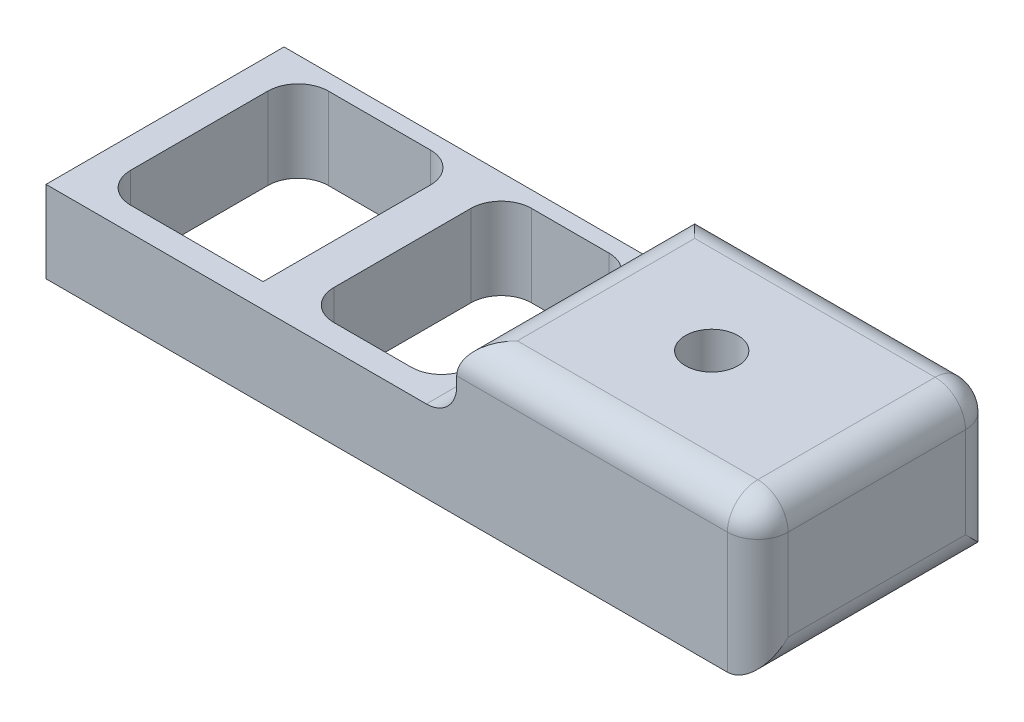
from build123d import *

# Parameters (mm, degrees)
SKETCH1_W           = 46.934067204
SKETCH1_H           = 15.695815502
BOSS_EXTRUDE1_DEPTH = 7
SKETCH2_W           = 46.934067204
SKETCH2_H           = 15.695815502
BOSS_EXTRUDE2_DEPTH = 3
SKETCH3_W           = 32.738111576
SKETCH3_H           = 6.605539494
CUT_EXTRUDE1_DEPTH  = 41.57096825
SKETCH4_W           = 9.10377614
SKETCH4_H           = 13.037427907
SKETCH4_W_2         = 10.726428155
CUT_EXTRUDE2_DEPTH  = 10
FILLET1_R           = 2
SKETCH5_R           = 1.732622303
CUT_EXTRUDE3_DEPTH  = 10


with BuildPart() as part:
    # Sketch1 → Boss-Extrude1 (new body)
    with BuildSketch(Plane(origin=(0, 0, 0), x_dir=(1, 0, 0), z_dir=(0, 1, 0))):
        with Locations((-12.583553639, 0)):
            Rectangle(SKETCH1_W, SKETCH1_H)
        Polygon((3.620053236, -6.243280219), (7.216865891, 0.013417956), (3.596812655, 6.256698176), (-3.620053236, 6.243280219), (-7.216865891, -0.013417956), (-3.596812655, -6.256698176), align=None, mode=Mode.SUBTRACT)
    extrude(amount=BOSS_EXTRUDE1_DEPTH)

    # Sketch2 → Boss-Extrude2 (add)
    with BuildSketch(Plane(origin=(0, 7, 0), x_dir=(1, 0, 0), z_dir=(0, 1, 0))):
        with Locations((-12.583553639, 0)):
            Rectangle(SKETCH2_W, SKETCH2_H)
    extrude(amount=BOSS_EXTRUDE2_DEPTH)

    # Sketch3 → Cut-Extrude1 (cut, through all)
    with BuildSketch(Plane.XY.offset(7.847907751)):
        with Locations((-25.336793279, 8.698923123)):
            Rectangle(SKETCH3_W, SKETCH3_H)
    extrude(amount=-CUT_EXTRUDE1_DEPTH, mode=Mode.SUBTRACT)

    # Sketch4 → Cut-Extrude2 (cut)
    with BuildSketch(Plane(origin=(0, 5.396153376, 0), x_dir=(1, 0, 0), z_dir=(0, 1, 0))):
        with Locations((-16.116840413, 0.270231687)):
            Rectangle(SKETCH4_W, SKETCH4_H)
        with Locations((-28.701467889, 0.270231687)):
            Rectangle(SKETCH4_W_2, SKETCH4_H)
    extrude(amount=-CUT_EXTRUDE2_DEPTH, mode=Mode.SUBTRACT)

    # Fillet1
    fillet1_edges = [part.edges().sort_by_distance(p)[0] for p in [
        (0.957871236, 10, -7.847907751),
        (10.883479963, 10, 0),
        (0.957871236, 10, 7.847907751),
        (-8.967737491, 10, 0),
        (10.883479963, 0, 0),
        (-8.967737491, 5.396153376, 0),
        (10.883479963, 5, 7.847907751),
        (10.883479963, 5, -7.847907751),
        (-20.668728483, 2.698076688, 6.248482266),
        (-20.668728483, 2.698076688, -6.788945641),
        (-11.564952343, 2.698076688, -6.788945641),
        (-11.564952343, 2.698076688, 6.248482266),
        (-23.338253811, 2.698076688, -6.788945641),
        (-34.064681966, 2.698076688, 6.248482266),
        (-34.064681966, 2.698076688, -6.788945641),
    ]]
    fillet(fillet1_edges, radius=FILLET1_R)

    # Sketch5 → Cut-Extrude3 (cut)
    with BuildSketch(Plane(origin=(0, 10, 0), x_dir=(1, 0, 0), z_dir=(0, 1, 0))):
        with Locations(Location((0, 0, 0), (0, 0, 270))):
            Circle(SKETCH5_R)
    extrude(amount=-CUT_EXTRUDE3_DEPTH, mode=Mode.SUBTRACT)


solid = part.part
